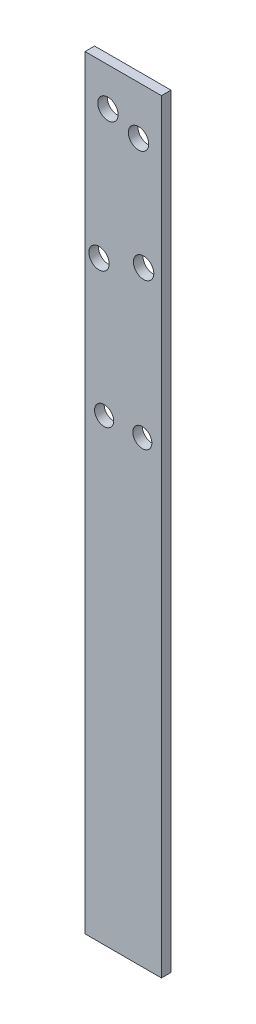
from build123d import *

# Parameters (mm, degrees)
SKETCH2_W           = 38.1
SKETCH2_H           = 381
SKETCH2_R           = 5.08
SKETCH2_R_2         = 4.7625
BOSS_EXTRUDE2_DEPTH = 4.7625


with BuildPart() as part:
    # Sketch2 → Boss-Extrude2 (new body)
    with BuildSketch(Plane.XY):
        with Locations((19.05, -190.5)):
            Rectangle(SKETCH2_W, SKETCH2_H)
        with Locations(Location((11.43, -19.05, 0), (0, 0, 180))):
            Circle(SKETCH2_R, mode=Mode.SUBTRACT)
        with Locations(Location((26.67, -24.13, 0), (0, 0, 180))):
            Circle(SKETCH2_R, mode=Mode.SUBTRACT)
        with Locations(Location((6.985, -85.725, 0), (0, 0, 180))):
            Circle(SKETCH2_R, mode=Mode.SUBTRACT)
        with Locations(Location((29.21, -78.74, 0), (0, 0, 180))):
            Circle(SKETCH2_R, mode=Mode.SUBTRACT)
        with Locations(Location((9.525, -152.4, 0), (0, 0, 180))):
            Circle(SKETCH2_R_2, mode=Mode.SUBTRACT)
        with Locations(Location((28.575, -152.4, 0), (0, 0, 180))):
            Circle(SKETCH2_R_2, mode=Mode.SUBTRACT)
    extrude(amount=BOSS_EXTRUDE2_DEPTH)


solid = part.part
